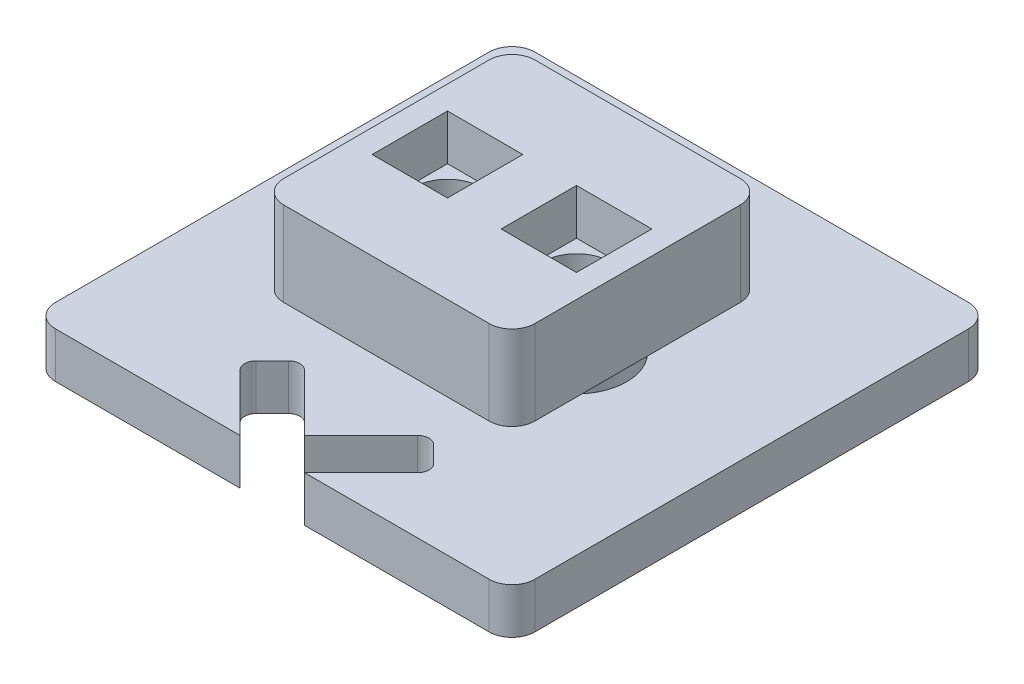
from build123d import *

# Parameters (mm, degrees)
SKETCH1_W           = 11
SKETCH1_H           = 11
BOSS_EXTRUDE1_DEPTH = 3.7
FILLET1_R           = 1
SKETCH2_W           = 3.3
SKETCH2_H           = 3.3
CUT_EXTRUDE1_DEPTH  = 2
SKETCH4_R           = 2.2
BOSS_EXTRUDE2_DEPTH = 3
BOSS_EXTRUDE3_DEPTH = 2
SKETCH3_R           = 1.5
CUT_EXTRUDE2_DEPTH  = 17.290794947
CUT_EXTRUDE3_DEPTH  = 16.57530096


with BuildPart() as part:
    # Sketch1 → Boss-Extrude1 (new body)
    with BuildSketch(Plane(origin=(0, 0, 0), x_dir=(1, 0, 0), z_dir=(0, 1, 0))):
        Rectangle(SKETCH1_W, SKETCH1_H)
    extrude(amount=BOSS_EXTRUDE1_DEPTH)

    # Fillet1
    fillet1_edges = [part.edges().sort_by_distance(p)[0] for p in [
        (5.5, 1.85, 5.5),
        (-5.5, 1.85, 5.5),
        (-5.5, 1.85, -5.5),
        (5.5, 1.85, -5.5),
    ]]
    fillet(fillet1_edges, radius=FILLET1_R)

    # Sketch2 → Cut-Extrude1 (cut)
    with BuildSketch(Plane(origin=(0, 3.7, 0), x_dir=(1, 0, 0), z_dir=(0, 1, 0))):
        with Locations((-2.825, 0)):
            Rectangle(SKETCH2_W, SKETCH2_H)
        with Locations((2.825, 0)):
            Rectangle(SKETCH2_W, SKETCH2_H)
    extrude(amount=-CUT_EXTRUDE1_DEPTH, mode=Mode.SUBTRACT)

    # Sketch4 → Boss-Extrude2 (add)
    with BuildSketch(Plane(origin=(0, 0, 0), x_dir=(-1, 0, 0), z_dir=(0, -1, 0))):
        with Locations(Location((2.825, 0, 0), (0, 0, 90))):
            Circle(SKETCH4_R)
        with Locations(Location((-2.825, 0, 0), (0, 0, 90))):
            Circle(SKETCH4_R)
    extrude(amount=BOSS_EXTRUDE2_DEPTH)

    # Sketch5 → Boss-Extrude3 (add)
    with BuildSketch(Plane(origin=(0, -3, 0), x_dir=(-1, 0, 0), z_dir=(0, -1, 0))):
        with BuildLine():
            Line((9.5, 10.5), (-9.5, 10.5))
            ThreePointArc((-9.5, 10.5), (-10.207106781, 10.207106781), (-10.5, 9.5))
            Line((-10.5, 9.5), (-10.5, -9.5))
            ThreePointArc((-10.5, -9.5), (-10.207106781, -10.207106781), (-9.5, -10.5))
            Line((-9.5, -10.5), (9.5, -10.5))
            ThreePointArc((9.5, -10.5), (10.207106781, -10.207106781), (10.5, -9.5))
            Line((10.5, -9.5), (10.5, 9.5))
            ThreePointArc((10.5, 9.5), (10.207106781, 10.207106781), (9.5, 10.5))
        make_face()
    extrude(amount=-BOSS_EXTRUDE3_DEPTH)

    # Sketch3 → Cut-Extrude2 (cut, through all)
    with BuildSketch(Plane(origin=(0, 3.7, 0), x_dir=(1, 0, 0), z_dir=(0, 1, 0))):
        with Locations(Location((-2.825, 0, 0), (0, 0, 270))):
            Circle(SKETCH3_R)
        with Locations(Location((2.825, 0, 0), (0, 0, 270))):
            Circle(SKETCH3_R)
    extrude(amount=-CUT_EXTRUDE2_DEPTH, mode=Mode.SUBTRACT)

    # Sketch7 → Cut-Extrude3 (cut, through all)
    with BuildSketch(Plane(origin=(0, -1, 0), x_dir=(1, 0, 0), z_dir=(0, 1, 0))):
        with BuildLine():
            Line((0, -9.085786438), (1.414213562, -10.5))
            Line((1.414213562, -10.5), (3.889087297, -8.025126266))
            ThreePointArc((3.889087297, -8.025126266), (4.035533906, -7.671572875), (3.889087297, -7.318019485))
            Line((3.889087297, -7.318019485), (3.181980515, -6.610912703))
            ThreePointArc((3.181980515, -6.610912703), (2.828427125, -6.464466094), (2.474873734, -6.610912703))
            Line((2.474873734, -6.610912703), (0, -9.085786438))
        make_face()
        with BuildLine():
            Line((-3.889087297, -8.025126266), (-1.414213562, -10.5))
            Line((-1.414213562, -10.5), (0, -9.085786438))
            Line((0, -9.085786438), (-2.474873734, -6.610912703))
            ThreePointArc((-2.474873734, -6.610912703), (-2.828427125, -6.464466094), (-3.181980515, -6.610912703))
            Line((-3.181980515, -6.610912703), (-3.889087297, -7.318019485))
            ThreePointArc((-3.889087297, -7.318019485), (-4.035533906, -7.671572875), (-3.889087297, -8.025126266))
        make_face()
        Polygon((-1.414213562, -10.5), (1.414213562, -10.5), (0, -9.085786438), align=None)
    extrude(amount=-CUT_EXTRUDE3_DEPTH, mode=Mode.SUBTRACT)


solid = part.part
